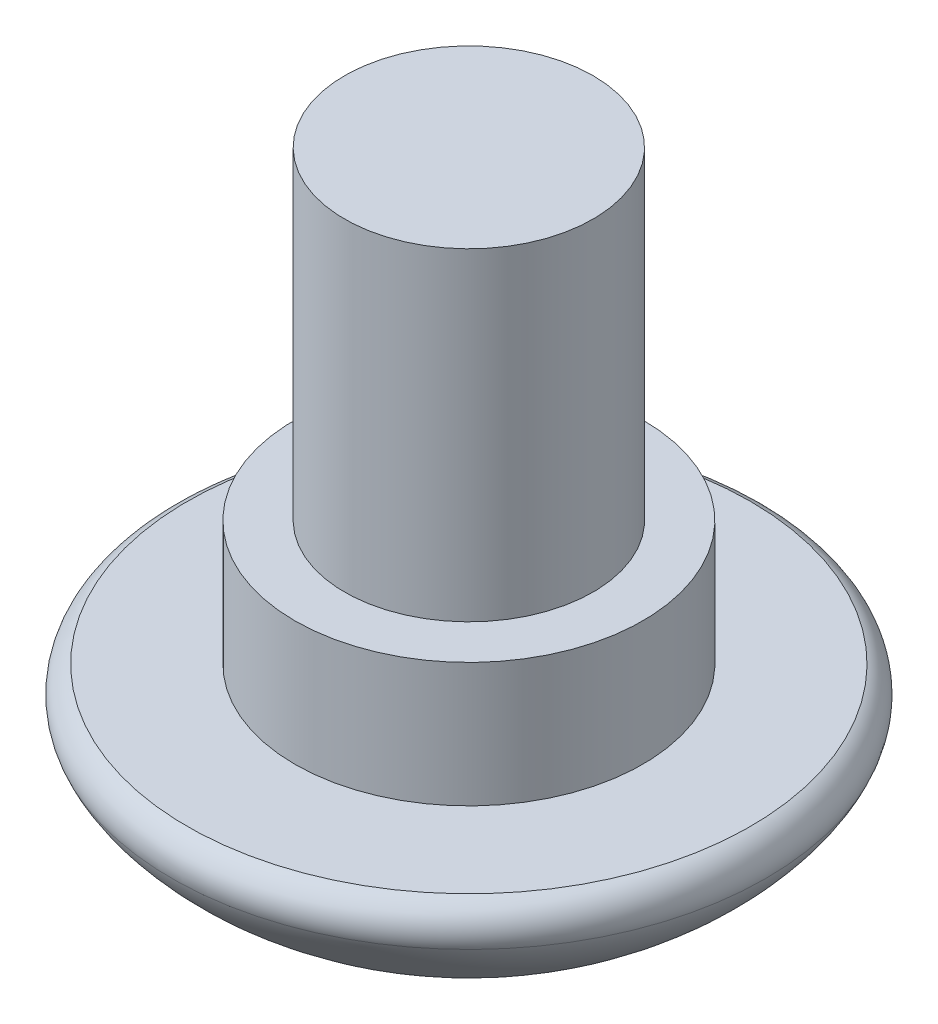
from build123d import *


with BuildPart() as part:
    # Sketch1 → Revolve1 (revolve)
    with BuildSketch(Plane.XY, mode=Mode.PRIVATE) as revolve1_sk:
        with BuildLine():
            Line((0, 0), (0, 4))
            Line((0, 4), (5.665073225, 4))
            ThreePointArc((5.665073225, 4), (5.975896248, 3.689038292), (5.975798184, 3.249370092))
            add(Edge.make_bspline(
                [(0, 0), (4.05719651, 0.732493998), (5.691820154, 2.564218754), (5.975798184, 3.249370092)],
                knots=[0, 0, 0, 0, 1, 1, 1, 1], degree=3))
        make_face()
        Polygon((0, 13), (0, 4), (3.5, 4), (3.5, 6.5), (2.5, 6.5), (2.5, 13), align=None)
    revolve(revolve1_sk.sketch.rotate(Axis((0, 0, 0), (0, 1, 0)), 90), axis=Axis((0, 0, 0), (0, 1, 0)))


solid = part.part
